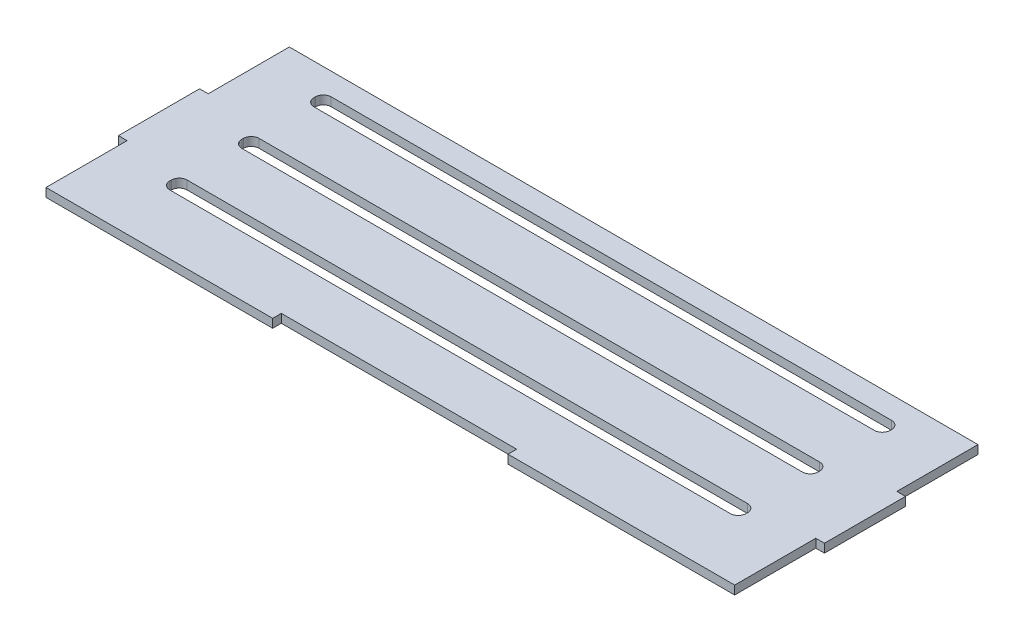
from build123d import *

# Parameters (mm, degrees)
SKETCH1_W           = 490
SKETCH1_H           = 168.89
BOSS_EXTRUDE1_DEPTH = 6
SKETCH2_W           = 163.333333334
SKETCH2_H           = 6
CUT_EXTRUDE1_DEPTH  = 519.324060892
SKETCH4_W           = 6
SKETCH4_H           = 56.296666667
CUT_EXTRUDE3_DEPTH  = 519.324060892
CUT_EXTRUDE4_DEPTH  = 519.324060892
LPATTERN1_COUNT     = 3
LPATTERN1_PITCH     = 50


with BuildPart() as part:
    # Sketch1 → Boss-Extrude1 (new body)
    with BuildSketch(Plane(origin=(0, 0, 0), x_dir=(1, 0, 0), z_dir=(0, 1, 0))):
        with Locations((245, 84.445)):
            Rectangle(SKETCH1_W, SKETCH1_H)
    extrude(amount=BOSS_EXTRUDE1_DEPTH)

    # Sketch2 → Cut-Extrude1 (cut, through all)
    with BuildSketch(Plane(origin=(0, 6, 0), x_dir=(1, 0, 0), z_dir=(0, 1, 0))):
        with Locations((245, 3)):
            Rectangle(SKETCH2_W, SKETCH2_H)
    extrude(amount=-CUT_EXTRUDE1_DEPTH, mode=Mode.SUBTRACT)

    # Sketch4 → Cut-Extrude3 (cut, through all)
    with BuildSketch(Plane(origin=(0, 6, 0), x_dir=(1, 0, 0), z_dir=(0, 1, 0))):
        with Locations((3, 140.741666667)):
            Rectangle(SKETCH4_W, SKETCH4_H)
        with Locations((3, 28.148333334)):
            Rectangle(SKETCH4_W, SKETCH4_H)
        with Locations((487, 28.148333334)):
            Rectangle(SKETCH4_W, SKETCH4_H)
        with Locations((487, 140.741666667)):
            Rectangle(SKETCH4_W, SKETCH4_H)
    extrude(amount=-CUT_EXTRUDE3_DEPTH, mode=Mode.SUBTRACT)

    # Sketch5 → Cut-Extrude4 (cut, through all)
    with BuildSketch(Plane(origin=(0, 6, 0), x_dir=(1, 0, 0), z_dir=(0, 1, 0))):
        with BuildLine():
            Line((50.5, 153.449523313), (439.5, 153.449523313))
            ThreePointArc((439.5, 153.449523313), (443.389087297, 151.838610609), (445, 147.949523313))
            Line((445, 147.949523313), (445, 146.949523313))
            ThreePointArc((445, 146.949523313), (443.389087297, 143.060436016), (439.5, 141.449523313))
            Line((439.5, 141.449523313), (50.5, 141.449523313))
            ThreePointArc((50.5, 141.449523313), (46.610912703, 143.060436016), (45, 146.949523313))
            Line((45, 146.949523313), (45, 147.949523313))
            ThreePointArc((45, 147.949523313), (46.610912703, 151.838610609), (50.5, 153.449523313))
        make_face()
    cut_extrude4 = extrude(amount=-CUT_EXTRUDE4_DEPTH, mode=Mode.SUBTRACT)

    # LPattern1: Cut-Extrude4 ×3
    with Locations(*[(0, 0, i * LPATTERN1_PITCH) for i in range(1, LPATTERN1_COUNT)]):
        add(cut_extrude4, mode=Mode.SUBTRACT)


solid = part.part
